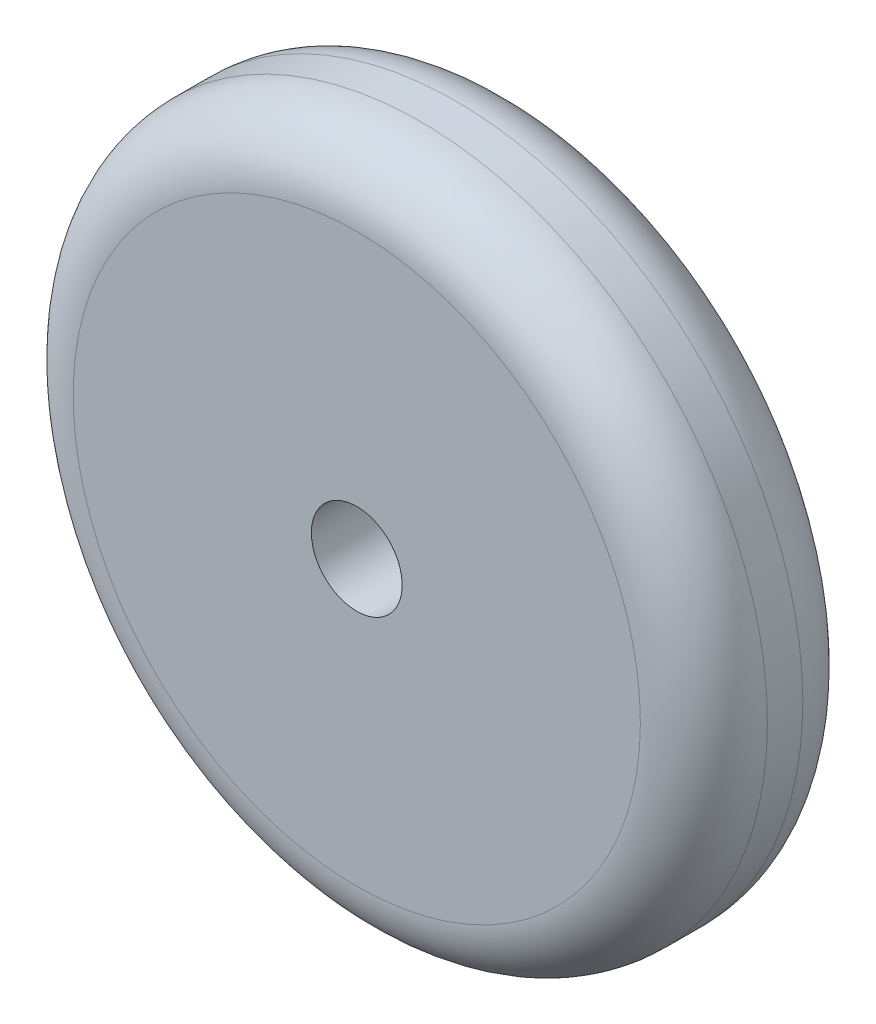
from build123d import *

# Parameters (mm, degrees)
SKETCH1_W = 84.455
SKETCH1_H = 45.466
FILLET1_R = 17.78


with BuildPart() as part:
    # Sketch1 → Revolve1 (revolve)
    with BuildSketch(Plane.XZ, mode=Mode.PRIVATE) as revolve1_sk:
        with Locations((54.9275, 0)):
            Rectangle(SKETCH1_W, SKETCH1_H)
    revolve(revolve1_sk.sketch.rotate(Axis((0, 0, 22.733), (0, 0, -1)), 180), axis=Axis((0, 0, 22.733), (0, 0, -1)))

    # Fillet1
    fillet1_edges = [part.edges().sort_by_distance(p)[0] for p in [
        (97.155, 0, 22.733),
        (97.155, 0, -22.733),
    ]]
    fillet(fillet1_edges, radius=FILLET1_R)


solid = part.part
